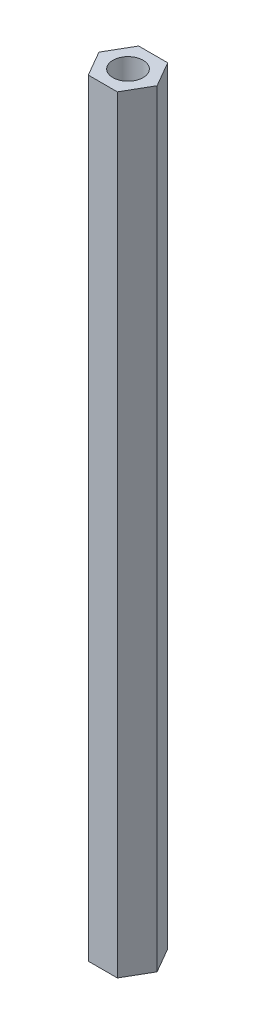
from build123d import *

# Parameters (mm, degrees)
BOSS_EXTRUDE1_DEPTH = 76.2
SKETCH2_R           = 1.5
CUT_EXTRUDE1_DEPTH  = 77.295631155


with BuildPart() as part:
    # Sketch1 → Boss-Extrude1 (new body)
    with BuildSketch(Plane(origin=(0, 0, 0), x_dir=(1, 0, 0), z_dir=(0, 1, 0))):
        Polygon((2.886751346, 0), (1.443375673, 2.5), (-1.443375673, 2.5), (-2.886751346, 0), (-1.443375673, -2.5), (1.443375673, -2.5), align=None)
    extrude(amount=BOSS_EXTRUDE1_DEPTH)

    # Sketch2 → Cut-Extrude1 (cut, through all)
    with BuildSketch(Plane(origin=(0, 76.2, 0), x_dir=(1, 0, 0), z_dir=(0, 1, 0))):
        with Locations(Location((0, 0, 0), (0, 0, 270))):
            Circle(SKETCH2_R)
    extrude(amount=-CUT_EXTRUDE1_DEPTH, mode=Mode.SUBTRACT)


solid = part.part
